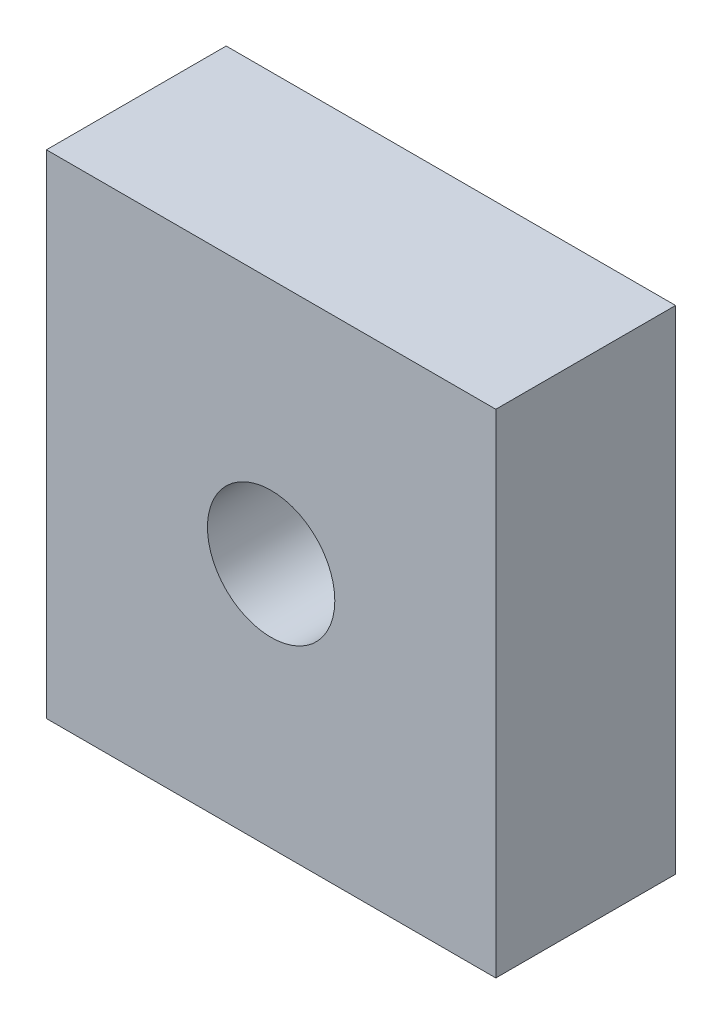
from build123d import *

# Parameters (mm, degrees)
SKETCH1_W                = 15.875
SKETCH1_H                = 17.4
BOSS_EXTRUDE1_DEPTH      = 6.35
M4_CLEARANCE_HOLE1_D     = 4.5
M4_CLEARANCE_HOLE1_DEPTH = 12.7
M4_CLEARANCE_HOLE1_TIP   = 1.351936393


with BuildPart() as part:
    # Sketch1 → Boss-Extrude1 (new body)
    with BuildSketch(Plane.XY):
        with Locations((-7.9375, 8.7)):
            Rectangle(SKETCH1_W, SKETCH1_H)
    extrude(amount=BOSS_EXTRUDE1_DEPTH)

    # M4 Clearance Hole1
    with Locations(Plane.XY.offset(6.35)):
        with Locations((-7.9375, 8.7)):
            Hole(M4_CLEARANCE_HOLE1_D / 2, depth=M4_CLEARANCE_HOLE1_DEPTH)
            with Locations((0, 0, -(M4_CLEARANCE_HOLE1_DEPTH + M4_CLEARANCE_HOLE1_TIP / 2))):  # 118° drill point
                Cone(0, M4_CLEARANCE_HOLE1_D / 2, M4_CLEARANCE_HOLE1_TIP, mode=Mode.SUBTRACT)


solid = part.part
